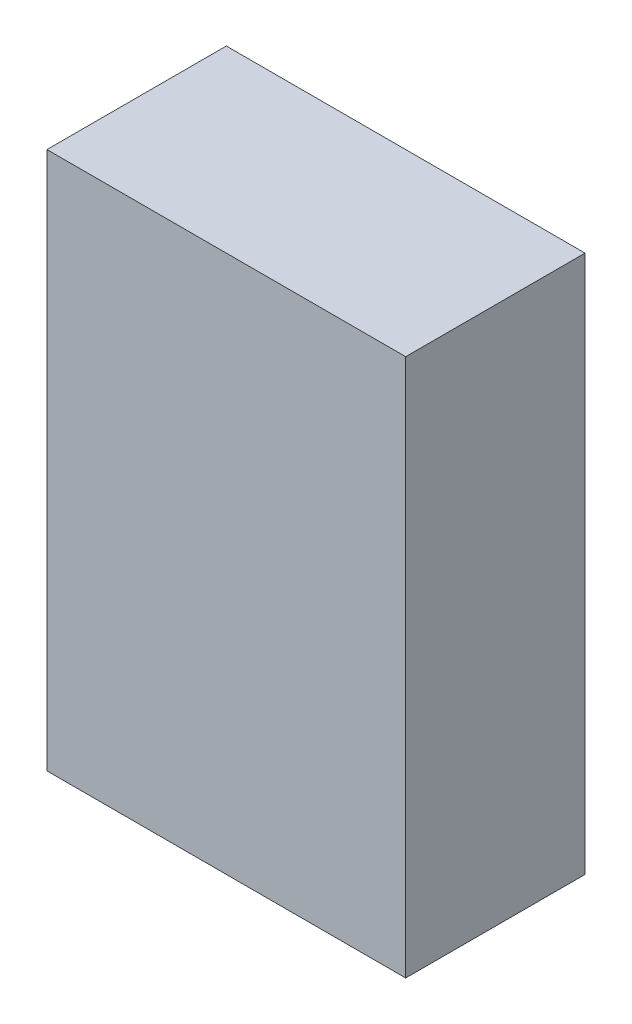
from build123d import *

# Parameters (mm, degrees)
SKETCH_1_W      = 20
SKETCH_1_H      = 30
EXTRUDE_1_DEPTH = 10


with BuildPart() as part:
    # 草图1 → 凸台-拉伸1 (new body)
    with BuildSketch(Plane.XY):
        with Locations((8.615853659, 13.524390244)):
            Rectangle(SKETCH_1_W, SKETCH_1_H)
    extrude(amount=EXTRUDE_1_DEPTH)


solid = part.part
